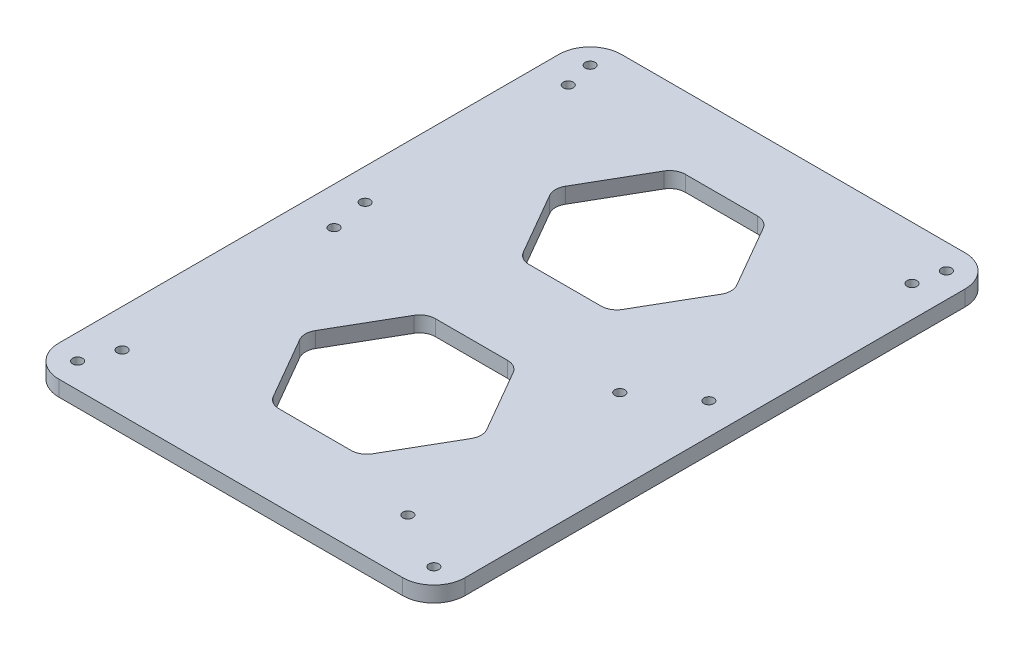
from build123d import *

# Parameters (mm, degrees)
SKETCH1_W           = 130
SKETCH1_H           = 180
SKETCH1_R           = 1.6
SKETCH1_W_2         = 116.84
SKETCH1_H_2         = 76.2
SKETCH1_W_3         = 120
SKETCH1_H_3         = 75
BOSS_EXTRUDE1_DEPTH = 5
FILLET1_R           = 10
CUT_EXTRUDE1_DEPTH  = 10
FILLET2_R           = 5


with BuildPart() as part:
    # Sketch1 → Boss-Extrude1 (new body)
    # profile 1 of 3: a face of its own
    with BuildSketch(Plane(origin=(0, 0, 0), x_dir=(1, 0, 0), z_dir=(0, 1, 0))):
        Rectangle(SKETCH1_W, SKETCH1_H)
        with Locations(Location((57, -82, 0), (0, 0, 270))):
            Circle(SKETCH1_R, mode=Mode.SUBTRACT)
        with Locations(Location((-57, -82, 0), (0, 0, 270))):
            Circle(SKETCH1_R, mode=Mode.SUBTRACT)
        with Locations(Location((57, 82, 0), (0, 0, 270))):
            Circle(SKETCH1_R, mode=Mode.SUBTRACT)
        with Locations(Location((-57, 82, 0), (0, 0, 270))):
            Circle(SKETCH1_R, mode=Mode.SUBTRACT)
        with Locations((0, -37.9)):
            Rectangle(SKETCH1_W_2, SKETCH1_H_2, mode=Mode.SUBTRACT)
        with Locations((0, 40.5)):
            Rectangle(SKETCH1_W_3, SKETCH1_H_3, mode=Mode.SUBTRACT)
    # profile 2 of 3: a face of its own
    with BuildSketch(Plane(origin=(0, 0, 0), x_dir=(1, 0, 0), z_dir=(0, 1, 0))):
        with Locations((0, 40.5)):
            Rectangle(SKETCH1_W_3, SKETCH1_H_3)
        with Locations(Location((55, 8, 0), (0, 0, 270))):
            Circle(SKETCH1_R, mode=Mode.SUBTRACT)
        with Locations(Location((55, 73, 0), (0, 0, 270))):
            Circle(SKETCH1_R, mode=Mode.SUBTRACT)
        with Locations(Location((-55, 8, 0), (0, 0, 270))):
            Circle(SKETCH1_R, mode=Mode.SUBTRACT)
        with Locations(Location((-55, 73, 0), (0, 0, 270))):
            Circle(SKETCH1_R, mode=Mode.SUBTRACT)
    # profile 3 of 3: a face of its own
    with BuildSketch(Plane(origin=(0, 0, 0), x_dir=(1, 0, 0), z_dir=(0, 1, 0))):
        with Locations((0, -37.9)):
            Rectangle(SKETCH1_W_2, SKETCH1_H_2)
        with Locations(Location((-52.96, -71.81, 0), (0, 0, 270))):
            Circle(SKETCH1_R, mode=Mode.SUBTRACT)
        with Locations(Location((-52.96, -3.99, 0), (0, 0, 270))):
            Circle(SKETCH1_R, mode=Mode.SUBTRACT)
        with Locations(Location((38.48, -71.81, 0), (0, 0, 270))):
            Circle(SKETCH1_R, mode=Mode.SUBTRACT)
        with Locations(Location((38.48, -3.99, 0), (0, 0, 270))):
            Circle(SKETCH1_R, mode=Mode.SUBTRACT)
    extrude(amount=BOSS_EXTRUDE1_DEPTH)

    # Fillet1
    fillet1_edges = [part.edges().sort_by_distance(p)[0] for p in [
        (65, 2.5, 90),
        (-65, 2.5, 90),
        (-65, 2.5, -90),
        (65, 2.5, -90),
    ]]
    fillet(fillet1_edges, radius=FILLET1_R)

    # Sketch2 → Cut-Extrude1 (cut)
    with BuildSketch(Plane(origin=(0, 5, 0), x_dir=(1, 0, 0), z_dir=(0, 1, 0))):
        Polygon((28.867513459, 42), (14.43375673, 67), (-14.43375673, 67), (-28.867513459, 42), (-14.43375673, 17), (14.43375673, 17), align=None)
        Polygon((28.867513459, -38), (14.43375673, -13), (-14.43375673, -13), (-28.867513459, -38), (-14.43375673, -63), (14.43375673, -63), align=None)
    extrude(amount=-CUT_EXTRUDE1_DEPTH, mode=Mode.SUBTRACT)

    # Fillet2
    fillet2_edges = [part.edges().sort_by_distance(p)[0] for p in [
        (28.867513459, 2.5, -42),
        (14.43375673, 2.5, -17),
        (-14.43375673, 2.5, -17),
        (-28.867513459, 2.5, -42),
        (-14.43375673, 2.5, -67),
        (14.43375673, 2.5, -67),
        (28.867513459, 2.5, 38),
        (14.43375673, 2.5, 63),
        (-14.43375673, 2.5, 63),
        (-28.867513459, 2.5, 38),
        (-14.43375673, 2.5, 13),
        (14.43375673, 2.5, 13),
    ]]
    fillet(fillet2_edges, radius=FILLET2_R)


solid = part.part
